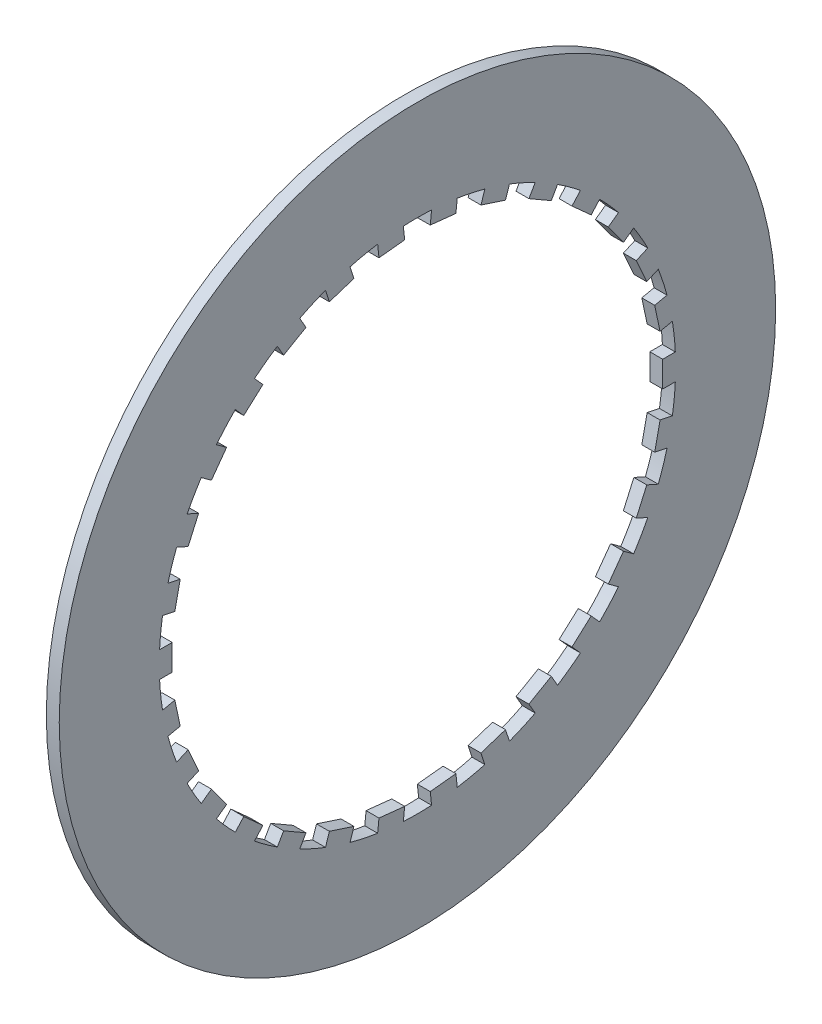
from build123d import *

# Parameters (mm, degrees)
SKETCH1_R           = 55.5
BOSS_EXTRUDE1_DEPTH = 2
BOSS_EXTRUDE2_DEPTH = 2
CIRPATTERN1_COUNT   = 30


with BuildPart() as part:
    # Sketch1 → Boss-Extrude1 (new body)
    with BuildSketch(Plane.YZ):
        Circle(SKETCH1_R)
        with BuildLine():
            ThreePointArc((40, 0), (-27.568097504, -28.982753492), (-2, 39.949968711))
            ThreePointArc((-2, 39.949968711), (0, 40), (2, 39.949968711))
            ThreePointArc((2, 39.949968711), (28.982753492, 27.568097504), (40, 0))
        make_face(mode=Mode.SUBTRACT)
    extrude(amount=BOSS_EXTRUDE1_DEPTH)

    # Sketch1<3> → Boss-Extrude2 (add)
    with BuildSketch(Plane.YZ):
        with BuildLine():
            Line((-2, 39.949968711), (-2, 38))
            Line((-2, 38), (2, 38))
            Line((2, 38), (2, 39.949968711))
            ThreePointArc((2, 39.949968711), (0, 40), (-2, 39.949968711))
        make_face()
    boss_extrude2 = extrude(amount=BOSS_EXTRUDE2_DEPTH)

    # CirPattern1: Boss-Extrude2 ×30 about axis
    cirpattern1_axis = Axis((2, 0, 0), (1, 0, 0))
    for i in range(1, CIRPATTERN1_COUNT):
        add(boss_extrude2.rotate(cirpattern1_axis, i * 360 / CIRPATTERN1_COUNT))


solid = part.part
